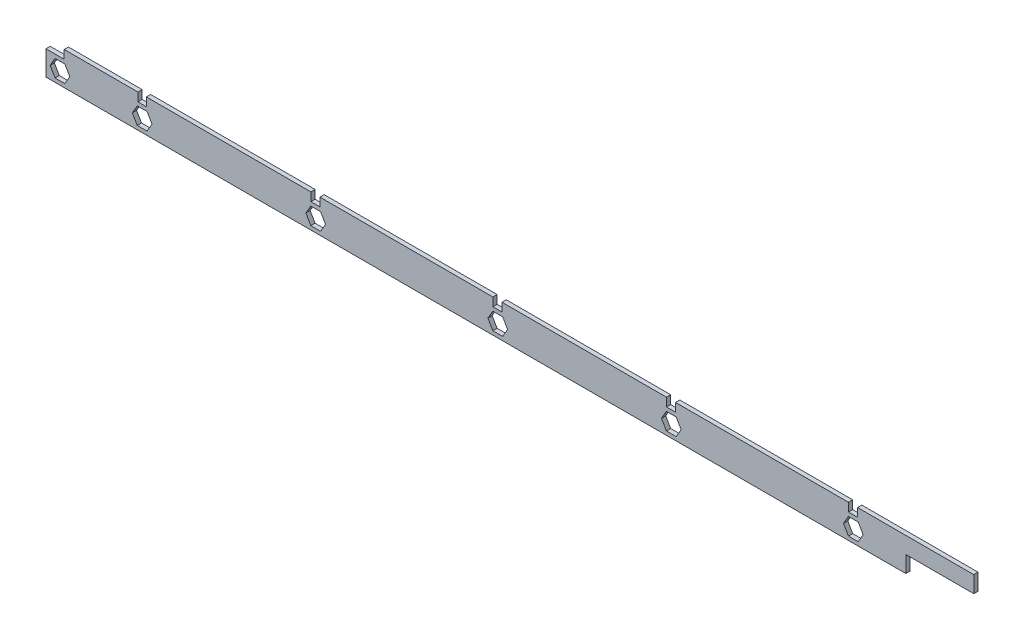
from build123d import *

# Parameters (mm, degrees)
BOSS_EXTRUDE1_DEPTH = 1.5875


with BuildPart() as part:
    # Sketch1 → Boss-Extrude1 (new body)
    with BuildSketch(Plane.XY):
        Polygon((6453.274222112, 2700.300995821), (6453.274222112, 2697.125995821), (6446.467022112, 2697.125995821), (6446.467022112, 2687.931195821), (6767.942122112, 2687.931195821), (6767.942122112, 2694.116095821), (6793.342122112, 2694.116095821), (6793.342122112, 2700.300995821), (6749.901772112, 2700.300995821), (6749.901772112, 2697.125995821), (6746.498172112, 2697.125995821), (6746.498172112, 2700.300995821), (6681.842472112, 2700.300995821), (6681.842472112, 2697.125995821), (6678.438872112, 2697.125995821), (6678.438872112, 2700.300995821), (6616.958172112, 2700.300995821), (6616.958172112, 2697.125995821), (6613.554572112, 2697.125995821), (6613.554572112, 2700.300995821), (6548.898872112, 2700.300995821), (6548.898872112, 2697.125995821), (6545.495272112, 2697.125995821), (6545.495272112, 2700.300995821), (6484.014572112, 2700.300995821), (6484.014572112, 2697.125995821), (6480.839572112, 2697.125995821), (6480.839572112, 2700.300995821), align=None)
        Polygon((6484.260159217, 2689.353595821), (6486.093246321, 2692.528595821), (6484.260159217, 2695.703595821), (6480.593985007, 2695.703595821), (6478.760897903, 2692.528595821), (6480.593985007, 2689.353595821), align=None, mode=Mode.SUBTRACT)
        Polygon((6549.144459217, 2689.353595821), (6550.977546321, 2692.528595821), (6549.144459217, 2695.703595821), (6545.478285007, 2695.703595821), (6543.645197903, 2692.528595821), (6545.478285007, 2689.353595821), align=None, mode=Mode.SUBTRACT)
        Polygon((6617.203759217, 2689.353595821), (6619.036846321, 2692.528595821), (6617.203759217, 2695.703595821), (6613.537585007, 2695.703595821), (6611.704497903, 2692.528595821), (6613.537585007, 2689.353595821), align=None, mode=Mode.SUBTRACT)
        Polygon((6682.088059217, 2689.353595821), (6683.921146321, 2692.528595821), (6682.088059217, 2695.703595821), (6678.421885007, 2695.703595821), (6676.588797903, 2692.528595821), (6678.421885007, 2689.353595821), align=None, mode=Mode.SUBTRACT)
        Polygon((6750.147359217, 2689.353595821), (6751.980446321, 2692.528595821), (6750.147359217, 2695.703595821), (6746.481185007, 2695.703595821), (6744.648097903, 2692.528595821), (6746.481185007, 2689.353595821), align=None, mode=Mode.SUBTRACT)
        Polygon((6453.519809217, 2689.353595821), (6455.352896321, 2692.528595821), (6453.519809217, 2695.703595821), (6449.853635007, 2695.703595821), (6448.020547903, 2692.528595821), (6449.853635007, 2689.353595821), align=None, mode=Mode.SUBTRACT)
    extrude(amount=BOSS_EXTRUDE1_DEPTH)


solid = part.part
